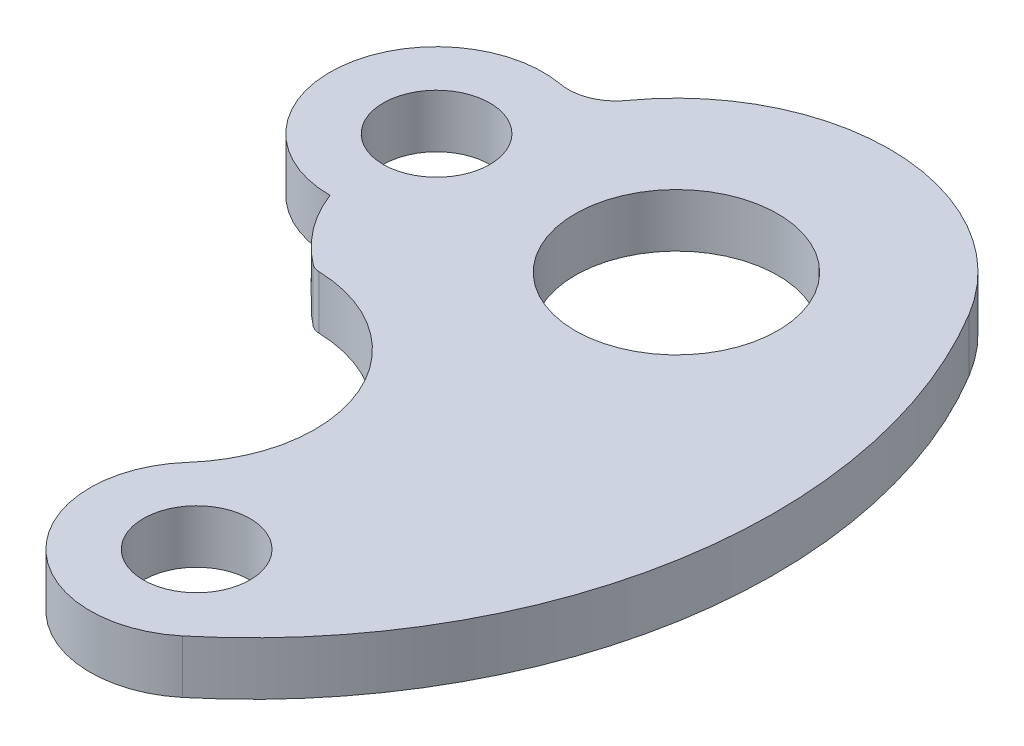
from build123d import *

# Parameters (mm, degrees)
SKETCH1_R           = 19
SKETCH1_R_2         = 10
BOSS_EXTRUDE1_DEPTH = 10


with BuildPart() as part:
    # Sketch1 → Boss-Extrude1 (new body)
    with BuildSketch(Plane(origin=(0, 0, 0), x_dir=(1, 0, 0), z_dir=(0, 1, 0))):
        with BuildLine():
            ThreePointArc((-41.436781609, 19.680027304), (-64.91984621, 1.788778062), (-45, -20))
            add(Edge.make_bspline(
                [(-45, -20), (-42.951295687, -25.183418909), (-39.715623944, -29.46325745), (-35.29298477, -32.839515621)],
                knots=[0, 0, 0, 0, 0.944416844, 0.944416844, 0.944416844, 0.944416844], degree=3))
            ThreePointArc((-35.29298477, -32.839515621), (-34.497009223, -33.27058744), (-33.607245283, -33.437081025))
            ThreePointArc((-33.607245283, -33.437081025), (-10.495230645, -49.128111854), (-14.943027733, -76.70692202))
            ThreePointArc((-14.943027733, -76.70692202), (-14.395104128, -103.884558947), (12.745045372, -105.413105413))
            ThreePointArc((12.745045372, -105.413105413), (46.894193375, -46.39540437), (34.279777206, 20.61302682))
            ThreePointArc((34.279777206, 20.61302682), (1.604592709, 39.96780307), (-32.517006803, 23.294726197))
            ThreePointArc((-32.517006803, 23.294726197), (-36.453132672, 20.194921951), (-41.436781609, 19.680027304))
        make_face()
        with Locations(Location((0, 0, 0), (0, 0, 270))):
            Circle(SKETCH1_R, mode=Mode.SUBTRACT)
        with Locations(Location((-45, 0, 0), (0, 0, 270))):
            Circle(SKETCH1_R_2, mode=Mode.SUBTRACT)
        with Locations(Location((0, -90, 0), (0, 0, 270))):
            Circle(SKETCH1_R_2, mode=Mode.SUBTRACT)
    extrude(amount=BOSS_EXTRUDE1_DEPTH)


solid = part.part
